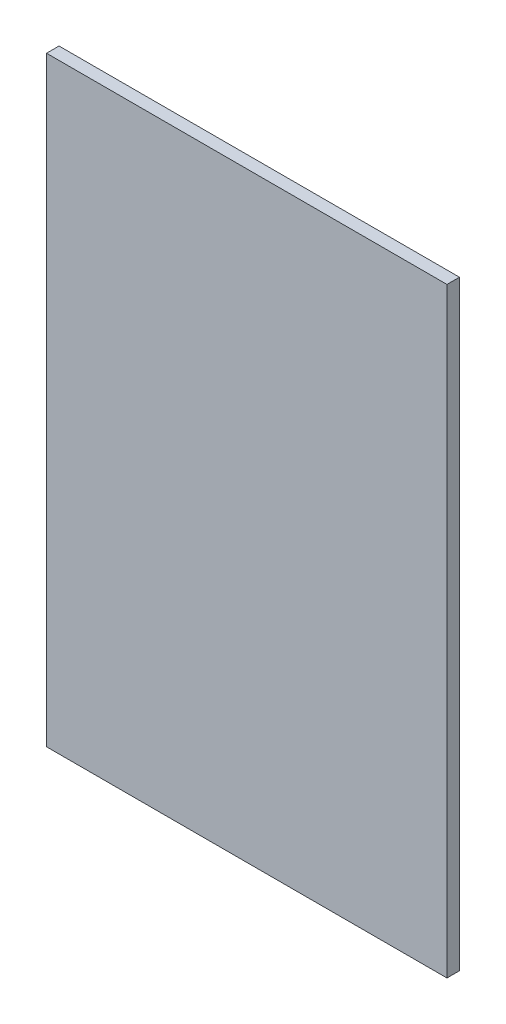
from build123d import *

# Parameters (mm, degrees)
SKETCH1_W           = 50.8
SKETCH1_H           = 76.2
BOSS_EXTRUDE1_DEPTH = 1.5875


with BuildPart() as part:
    # Sketch1 → Boss-Extrude1 (new body)
    with BuildSketch(Plane.XY):
        with Locations((25.4, 38.1)):
            Rectangle(SKETCH1_W, SKETCH1_H)
    extrude(amount=BOSS_EXTRUDE1_DEPTH)


solid = part.part
